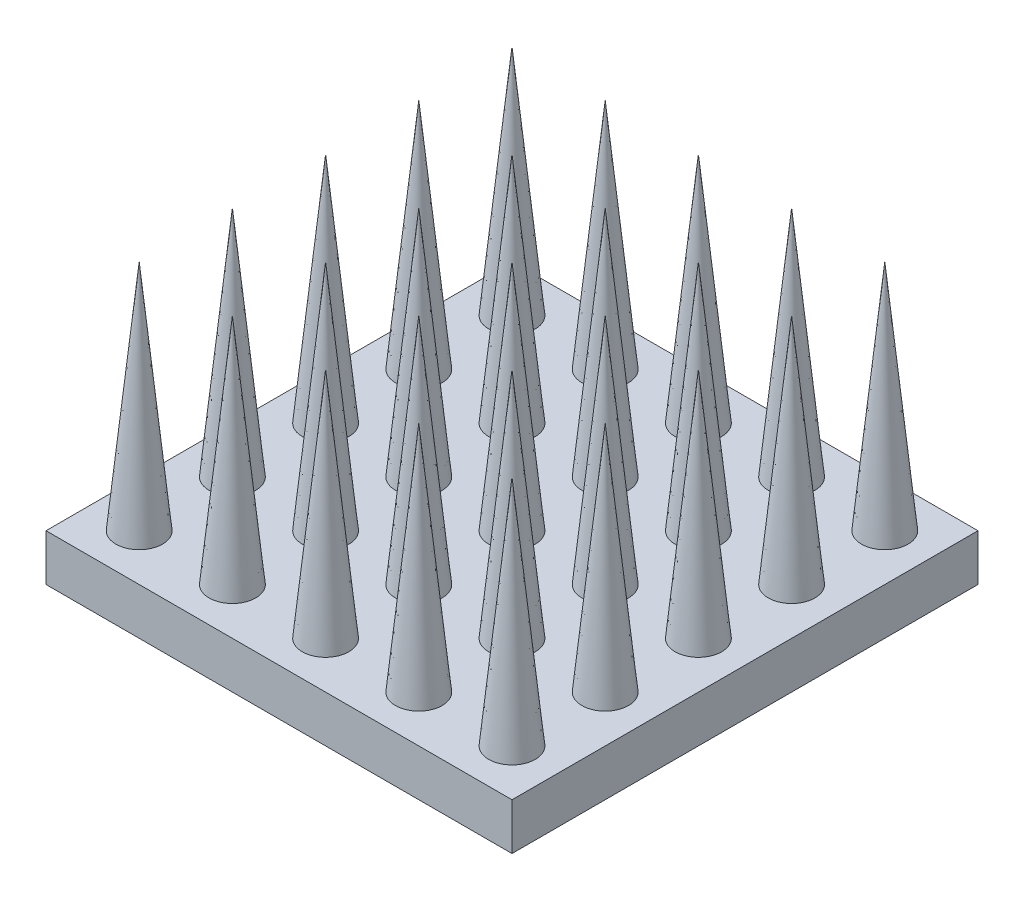
from build123d import *

# Parameters (mm, degrees)
SKETCH_1_W             = 10
SKETCH_1_H             = 10
EXTRUDE_1_DEPTH        = 1
PATTERN_LINEAR_8_COUNT = 5
PATTERN_LINEAR_8_PITCH = 2
PATTERN_LINEAR_9_COUNT = 5
PATTERN_LINEAR_9_PITCH = 2


with BuildPart() as part:
    # 草圖1 → 填料-伸長1 (new body)
    with BuildSketch(Plane(origin=(0, 0, 0), x_dir=(1, 0, 0), z_dir=(0, 1, 0))):
        Rectangle(SKETCH_1_W, SKETCH_1_H)
    extrude(amount=EXTRUDE_1_DEPTH)


with BuildPart() as body_2:
    # 草圖4 → 旋轉1 (revolve)
    with BuildSketch(Plane(origin=(0, 0, -4), x_dir=(-1, 0, 0), z_dir=(0, 0, -1)), mode=Mode.PRIVATE) as revolve_1_sk:
        Polygon((-4, 1), (-4, 6), (-3.5, 1), align=None)
    revolve(revolve_1_sk.sketch.rotate(Axis((4, 1, -4), (0, 1, 0)), 180), axis=Axis((4, 1, -4), (0, 1, 0)))


with BuildPart() as pattern_linear_8_1:
    # 直線複製排列8: pattern copy
    add(body_2.part.moved(Location(Vector(0, 0, 1) * (1 * PATTERN_LINEAR_8_PITCH))))


with BuildPart() as pattern_linear_8_2:
    # 直線複製排列8: pattern copy
    add(body_2.part.moved(Location(Vector(0, 0, 1) * (2 * PATTERN_LINEAR_8_PITCH))))


with BuildPart() as pattern_linear_8_3:
    # 直線複製排列8: pattern copy
    add(body_2.part.moved(Location(Vector(0, 0, 1) * (3 * PATTERN_LINEAR_8_PITCH))))


with BuildPart() as pattern_linear_8_4:
    # 直線複製排列8: pattern copy
    add(body_2.part.moved(Location(Vector(0, 0, 1) * (4 * PATTERN_LINEAR_8_PITCH))))


with BuildPart() as pattern_linear_9_1:
    # 直線複製排列9: pattern copy
    add(pattern_linear_8_4.part.moved(Location(Vector(-1, 0, 0) * (1 * PATTERN_LINEAR_9_PITCH))))


with BuildPart() as pattern_linear_9_2:
    # 直線複製排列9: pattern copy
    add(pattern_linear_8_4.part.moved(Location(Vector(-1, 0, 0) * (2 * PATTERN_LINEAR_9_PITCH))))


with BuildPart() as pattern_linear_9_3:
    # 直線複製排列9: pattern copy
    add(pattern_linear_8_4.part.moved(Location(Vector(-1, 0, 0) * (3 * PATTERN_LINEAR_9_PITCH))))


with BuildPart() as pattern_linear_9_4:
    # 直線複製排列9: pattern copy
    add(pattern_linear_8_4.part.moved(Location(Vector(-1, 0, 0) * (4 * PATTERN_LINEAR_9_PITCH))))


with BuildPart() as pattern_linear_9_5:
    # 直線複製排列9: pattern copy
    add(pattern_linear_8_3.part.moved(Location(Vector(-1, 0, 0) * (1 * PATTERN_LINEAR_9_PITCH))))


with BuildPart() as pattern_linear_9_6:
    # 直線複製排列9: pattern copy
    add(pattern_linear_8_3.part.moved(Location(Vector(-1, 0, 0) * (2 * PATTERN_LINEAR_9_PITCH))))


with BuildPart() as pattern_linear_9_7:
    # 直線複製排列9: pattern copy
    add(pattern_linear_8_3.part.moved(Location(Vector(-1, 0, 0) * (3 * PATTERN_LINEAR_9_PITCH))))


with BuildPart() as pattern_linear_9_8:
    # 直線複製排列9: pattern copy
    add(pattern_linear_8_3.part.moved(Location(Vector(-1, 0, 0) * (4 * PATTERN_LINEAR_9_PITCH))))


with BuildPart() as pattern_linear_9_9:
    # 直線複製排列9: pattern copy
    add(pattern_linear_8_2.part.moved(Location(Vector(-1, 0, 0) * (1 * PATTERN_LINEAR_9_PITCH))))


with BuildPart() as pattern_linear_9_10:
    # 直線複製排列9: pattern copy
    add(pattern_linear_8_2.part.moved(Location(Vector(-1, 0, 0) * (2 * PATTERN_LINEAR_9_PITCH))))


with BuildPart() as pattern_linear_9_11:
    # 直線複製排列9: pattern copy
    add(pattern_linear_8_2.part.moved(Location(Vector(-1, 0, 0) * (3 * PATTERN_LINEAR_9_PITCH))))


with BuildPart() as pattern_linear_9_12:
    # 直線複製排列9: pattern copy
    add(pattern_linear_8_2.part.moved(Location(Vector(-1, 0, 0) * (4 * PATTERN_LINEAR_9_PITCH))))


with BuildPart() as pattern_linear_9_13:
    # 直線複製排列9: pattern copy
    add(pattern_linear_8_1.part.moved(Location(Vector(-1, 0, 0) * (1 * PATTERN_LINEAR_9_PITCH))))


with BuildPart() as pattern_linear_9_14:
    # 直線複製排列9: pattern copy
    add(pattern_linear_8_1.part.moved(Location(Vector(-1, 0, 0) * (2 * PATTERN_LINEAR_9_PITCH))))


with BuildPart() as pattern_linear_9_15:
    # 直線複製排列9: pattern copy
    add(pattern_linear_8_1.part.moved(Location(Vector(-1, 0, 0) * (3 * PATTERN_LINEAR_9_PITCH))))


with BuildPart() as pattern_linear_9_16:
    # 直線複製排列9: pattern copy
    add(pattern_linear_8_1.part.moved(Location(Vector(-1, 0, 0) * (4 * PATTERN_LINEAR_9_PITCH))))


with BuildPart() as pattern_linear_9_17:
    # 直線複製排列9: pattern copy
    add(body_2.part.moved(Location(Vector(-1, 0, 0) * (1 * PATTERN_LINEAR_9_PITCH))))


with BuildPart() as pattern_linear_9_18:
    # 直線複製排列9: pattern copy
    add(body_2.part.moved(Location(Vector(-1, 0, 0) * (2 * PATTERN_LINEAR_9_PITCH))))


with BuildPart() as pattern_linear_9_19:
    # 直線複製排列9: pattern copy
    add(body_2.part.moved(Location(Vector(-1, 0, 0) * (3 * PATTERN_LINEAR_9_PITCH))))


with BuildPart() as pattern_linear_9_20:
    # 直線複製排列9: pattern copy
    add(body_2.part.moved(Location(Vector(-1, 0, 0) * (4 * PATTERN_LINEAR_9_PITCH))))


solid = Compound([part.part, body_2.part, pattern_linear_8_1.part, pattern_linear_8_2.part, pattern_linear_8_3.part, pattern_linear_8_4.part, pattern_linear_9_1.part, pattern_linear_9_2.part, pattern_linear_9_3.part, pattern_linear_9_4.part, pattern_linear_9_5.part, pattern_linear_9_6.part, pattern_linear_9_7.part, pattern_linear_9_8.part, pattern_linear_9_9.part, pattern_linear_9_10.part, pattern_linear_9_11.part, pattern_linear_9_12.part, pattern_linear_9_13.part, pattern_linear_9_14.part, pattern_linear_9_15.part, pattern_linear_9_16.part, pattern_linear_9_17.part, pattern_linear_9_18.part, pattern_linear_9_19.part, pattern_linear_9_20.part])
